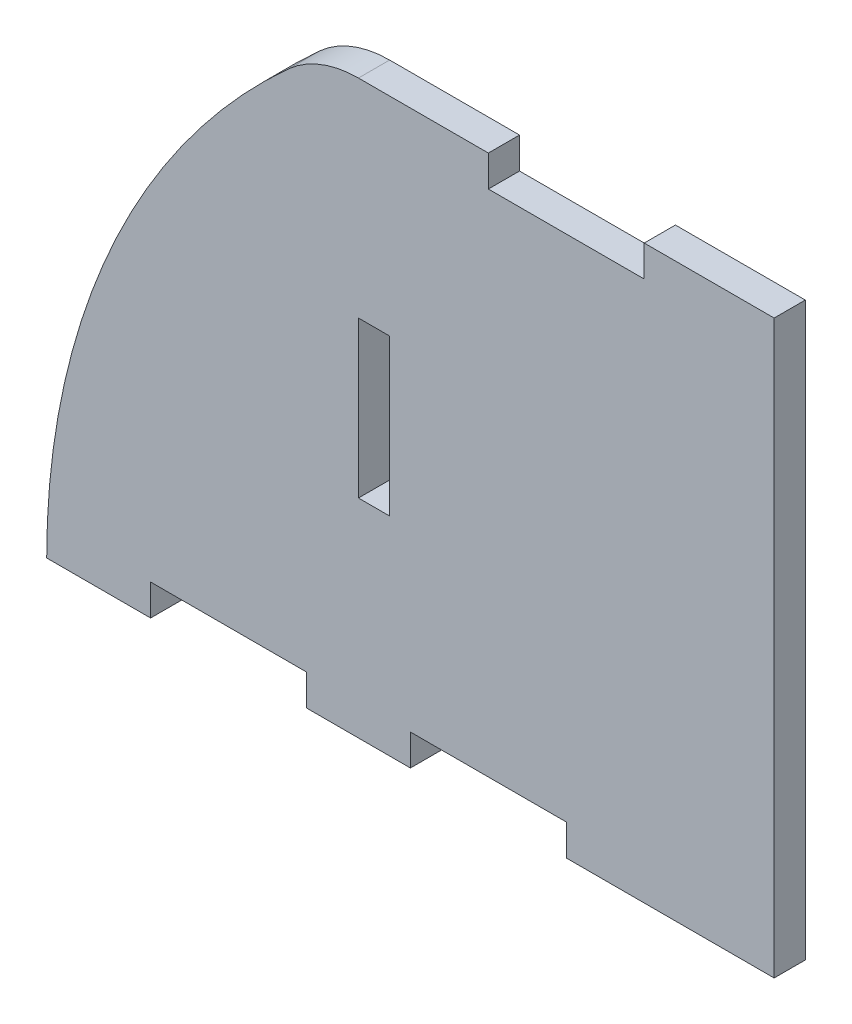
from build123d import *

# Parameters (mm, degrees)
BOSS_EXTRUDE1_DEPTH = 3
SKETCH2_W           = 15
SKETCH2_H           = 3
SKETCH2_W_2         = 3
SKETCH2_H_2         = 15
CUT_EXTRUDE1_DEPTH  = 90.073003767


with BuildPart() as part:
    # Sketch1 → Boss-Extrude1 (new body)
    with BuildSketch(Plane.XY):
        with BuildLine():
            Line((0, 0), (0, 55))
            Line((0, 55), (-40, 55))
            ThreePointArc((-40, 55), (-43.589790793, 54.333456062), (-46.701030928, 52.422680412))
            ThreePointArc((-46.701030928, 52.422680412), (-63.912940621, 28.683529165), (-70, 0))
            Line((-70, 0), (0, 0))
        make_face()
    extrude(amount=BOSS_EXTRUDE1_DEPTH)

    # Sketch2 → Cut-Extrude1 (cut, through all)
    with BuildSketch(Plane.XY.offset(3)):
        with Locations((-20, 53.5)):
            Rectangle(SKETCH2_W, SKETCH2_H)
        with Locations((-27.5, 1.5)):
            Rectangle(SKETCH2_W, SKETCH2_H)
        with Locations((-52.5, 1.5)):
            Rectangle(SKETCH2_W, SKETCH2_H)
        with Locations((-38.5, 27.5)):
            Rectangle(SKETCH2_W_2, SKETCH2_H_2)
    extrude(amount=-CUT_EXTRUDE1_DEPTH, mode=Mode.SUBTRACT)


solid = part.part
